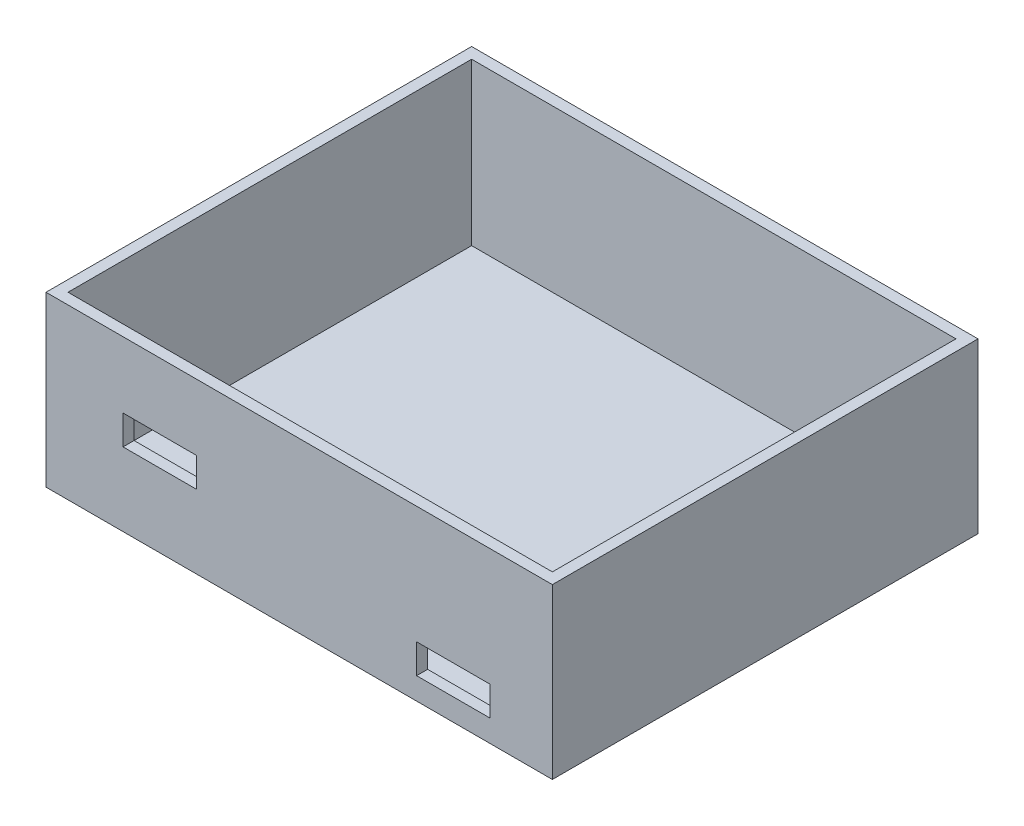
from build123d import *

# Parameters (mm, degrees)
BOSS_EXTRUDE2_DEPTH = 1
BOSS_EXTRUDE3_DEPTH = 23
SKETCH1_4_W         = 66
SKETCH1_4_H         = 1.5
BOSS_EXTRUDE4_DEPTH = 23
SKETCH5_W           = 10
SKETCH5_H           = 4
CUT_EXTRUDE3_DEPTH  = 10


with BuildPart() as part:
    # Sketch1 → Boss-Extrude2 (new body)
    with BuildSketch(Plane(origin=(0, 0, 0), x_dir=(1, 0, 0), z_dir=(0, 1, 0))):
        Polygon((-33.571389819, -30.056333369), (-33.571389819, -28.556333369), (32.428610181, -28.556333369), (32.428610181, -30.056333369), (33.928610181, -30.056333369), (33.928610181, 27.943666631), (-35.071389819, 27.943666631), (-35.071389819, -30.056333369), align=None)
    extrude(amount=BOSS_EXTRUDE2_DEPTH)

    # Sketch1<3> → Boss-Extrude3 (add)
    with BuildSketch(Plane(origin=(0, 0, 0), x_dir=(1, 0, 0), z_dir=(0, 1, 0))):
        Polygon((-33.571389819, -30.056333369), (-33.571389819, -28.556333369), (-33.571389819, 26.443666631), (32.428610181, 26.443666631), (32.428610181, -28.556333369), (32.428610181, -30.056333369), (33.928610181, -30.056333369), (33.928610181, 27.943666631), (-35.071389819, 27.943666631), (-35.071389819, -30.056333369), align=None)
    extrude(amount=BOSS_EXTRUDE3_DEPTH)

    # Sketch1<4> → Boss-Extrude4 (add)
    with BuildSketch(Plane(origin=(0, 0, 0), x_dir=(1, 0, 0), z_dir=(0, 1, 0))):
        with Locations((-0.571389819, -29.306333369)):
            Rectangle(SKETCH1_4_W, SKETCH1_4_H)
    extrude(amount=BOSS_EXTRUDE4_DEPTH)

    # Sketch5 → Cut-Extrude3 (cut)
    with BuildSketch(Plane.XY.offset(30.056333369)):
        with Locations((20.428610181, 5)):
            Rectangle(SKETCH5_W, SKETCH5_H)
        with Locations((-19.571389819, 12)):
            Rectangle(SKETCH5_W, SKETCH5_H)
    extrude(amount=-CUT_EXTRUDE3_DEPTH, mode=Mode.SUBTRACT)


solid = part.part
